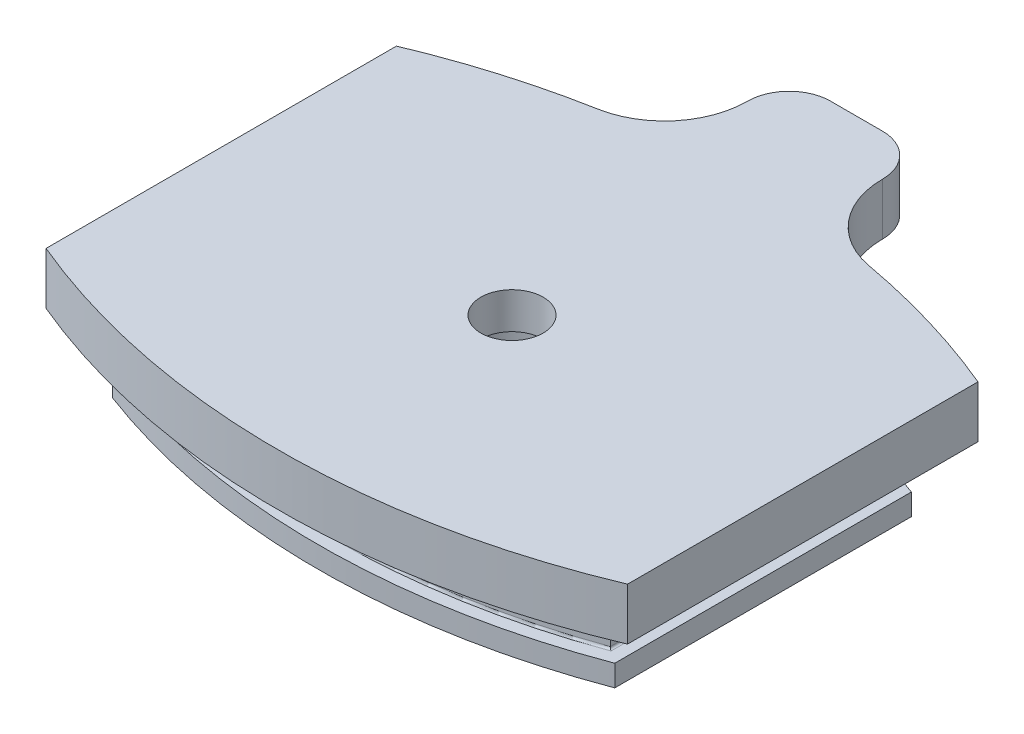
from build123d import *

# Parameters (mm, degrees)
BOSS_EXTRUDE1_DEPTH = 6.35
BOSS_EXTRUDE2_DEPTH = 8.7122
CUT_EXTRUDE1_START  = 2.54
SKETCH3_W           = 71.12
SKETCH3_H           = 57.15
CUT_EXTRUDE1_DEPTH  = 3.556
HOLE1_D             = 7.62
CUT_EXTRUDE2_DEPTH  = 10.6172
SKETCH8_W           = 22.86
SKETCH8_H           = 22.86
SKETCH8_W_2         = 17.78
SKETCH8_H_2         = 17.78
BOSS_EXTRUDE3_DEPTH = 10.6172
FILLET1_R           = 0.254
FILLET2_R           = 6.604
FILLET3_R           = 9.144
CHAMFER1_SIZE       = 1.016
BOSS_EXTRUDE4_DEPTH = 6.35


with BuildPart() as part:
    # Sketch1 → Boss-Extrude1 (new body)
    with BuildSketch(Plane(origin=(0, 0, 0), x_dir=(1, 0, 0), z_dir=(0, 1, 0))):
        with BuildLine():
            Line((-35.56, 21.431101635), (-35.56, -21.431101635))
            ThreePointArc((-35.56, -21.431101635), (0, -28.575), (35.56, -21.431101635))
            Line((35.56, -21.431101635), (35.56, 21.431101635))
            ThreePointArc((35.56, 21.431101635), (0, 28.575), (-35.56, 21.431101635))
        make_face()
    extrude(amount=-BOSS_EXTRUDE1_DEPTH)

    # Sketch2 → Boss-Extrude2 (add)
    with BuildSketch(Plane.XZ.offset(6.35)):
        with BuildLine():
            Line((30.7086, -18.139073262), (30.7086, 18.139073262))
            ThreePointArc((30.7086, 18.139073262), (0, 23.7236), (-30.7086, 18.139073262))
            Line((-30.7086, 18.139073262), (-30.7086, -18.139073262))
            ThreePointArc((-30.7086, -18.139073262), (0, -23.7236), (30.7086, -18.139073262))
        make_face()
    extrude(amount=BOSS_EXTRUDE2_DEPTH)

    # Sketch3 → Cut-Extrude1 (cut)
    with BuildSketch(Plane.XZ.offset(6.35).offset(CUT_EXTRUDE1_START)):
        Rectangle(SKETCH3_W, SKETCH3_H)
        with BuildLine():
            Line((28.9306, -16.898824264), (28.9306, 16.898824264))
            ThreePointArc((28.9306, 16.898824264), (0, 21.9456), (-28.9306, 16.898824264))
            Line((-28.9306, 16.898824264), (-28.9306, -16.898824264))
            ThreePointArc((-28.9306, -16.898824264), (0, -21.9456), (28.9306, -16.898824264))
        make_face(mode=Mode.SUBTRACT)
    extrude(amount=CUT_EXTRUDE1_DEPTH, mode=Mode.SUBTRACT)

    # Hole1 (through all)
    with Locations(Plane(origin=(0, -15.0622, 0), x_dir=(-1, 0, 0), z_dir=(0, -1, 0))):
        with Locations((0, 0)):
            Hole(HOLE1_D / 2)

    # Sketch7 → Cut-Extrude2 (cut)
    with BuildSketch(Plane.XZ.offset(15.0622)):
        with BuildLine():
            Line((25.6286, -14.54323086), (25.6286, 14.54323086))
            ThreePointArc((25.6286, 14.54323086), (0, 18.6436), (-25.6286, 14.54323086))
            Line((-25.6286, 14.54323086), (-25.6286, -14.54323086))
            ThreePointArc((-25.6286, -14.54323086), (0, -18.6436), (25.6286, -14.54323086))
        make_face()
    extrude(amount=-CUT_EXTRUDE2_DEPTH, mode=Mode.SUBTRACT)

    # Sketch8 → Boss-Extrude3 (add)
    with BuildSketch(Plane.XZ.offset(4.445)):
        Rectangle(SKETCH8_W, SKETCH8_H)
        Rectangle(SKETCH8_W_2, SKETCH8_H_2, mode=Mode.SUBTRACT)
    extrude(amount=BOSS_EXTRUDE3_DEPTH)

    # Fillet1
    fillet1_edges = [part.edges().sort_by_distance(p)[0] for p in [
        (0, -8.89, -21.9456),
        (28.9306, -8.89, 0),
        (0, -8.89, 21.9456),
        (-28.9306, -8.89, 0),
        (0, -12.446, -21.9456),
        (28.9306, -12.446, 0),
        (0, -12.446, 21.9456),
        (-28.9306, -12.446, 0),
    ]]
    fillet(fillet1_edges, radius=FILLET1_R)

    # Fillet2
    fillet2_edges = [part.edges().sort_by_distance(p)[0] for p in [
        (8.89, -9.7536, -8.89),
        (-8.89, -9.7536, -8.89),
        (-8.89, -9.7536, 8.89),
        (8.89, -9.7536, 8.89),
    ]]
    fillet(fillet2_edges, radius=FILLET2_R)

    # Fillet3
    fillet3_edges = [part.edges().sort_by_distance(p)[0] for p in [
        (-11.43, -9.7536, -11.43),
        (-11.43, -9.7536, 11.43),
        (11.43, -9.7536, 11.43),
        (11.43, -9.7536, -11.43),
    ]]
    fillet(fillet3_edges, radius=FILLET3_R)

    # Chamfer1
    chamfer1_edges = [part.edges().sort_by_distance(p)[0] for p in [
        (-8.89, -15.0622, 0),
        (0, -15.0622, -8.89),
        (8.89, -15.0622, 0),
        (0, -15.0622, 8.89),
        (-6.955733183, -15.0622, -6.955733183),
        (6.955733183, -15.0622, -6.955733183),
        (-6.955733183, -15.0622, 6.955733183),
        (6.955733183, -15.0622, 6.955733183),
        (-11.43, -15.0622, 0),
        (0, -15.0622, 11.43),
        (0, -15.0622, -11.43),
        (11.43, -15.0622, 0),
        (8.751784407, -15.0622, -8.751784407),
        (-8.751784407, -15.0622, -8.751784407),
        (8.751784407, -15.0622, 8.751784407),
        (-8.751784407, -15.0622, 8.751784407),
        (0, -15.0622, -18.6436),
        (25.6286, -15.0622, 0),
        (0, -15.0622, 18.6436),
        (-25.6286, -15.0622, 0),
    ]]
    chamfer(chamfer1_edges, length=CHAMFER1_SIZE)

    # Sketch9 → Boss-Extrude4 (add)
    with BuildSketch(Plane(origin=(0, 0, 0), x_dir=(1, 0, 0), z_dir=(0, 1, 0))):
        with BuildLine():
            Line((-3.175, 42.142831106), (3.175, 42.142831106))
            ThreePointArc((3.175, 42.142831106), (6.767102448, 40.654933554), (8.255, 37.062831106))
            ThreePointArc((8.255, 37.062831106), (10.610545149, 30.557749671), (16.584937888, 27.069009381))
            ThreePointArc((16.584937888, 27.069009381), (0, 28.575), (-16.584937888, 27.069009381))
            ThreePointArc((-16.584937888, 27.069009381), (-10.610545149, 30.557749671), (-8.255, 37.062831106))
            ThreePointArc((-8.255, 37.062831106), (-6.767102448, 40.654933554), (-3.175, 42.142831106))
        make_face()
    extrude(amount=-BOSS_EXTRUDE4_DEPTH)


solid = part.part
